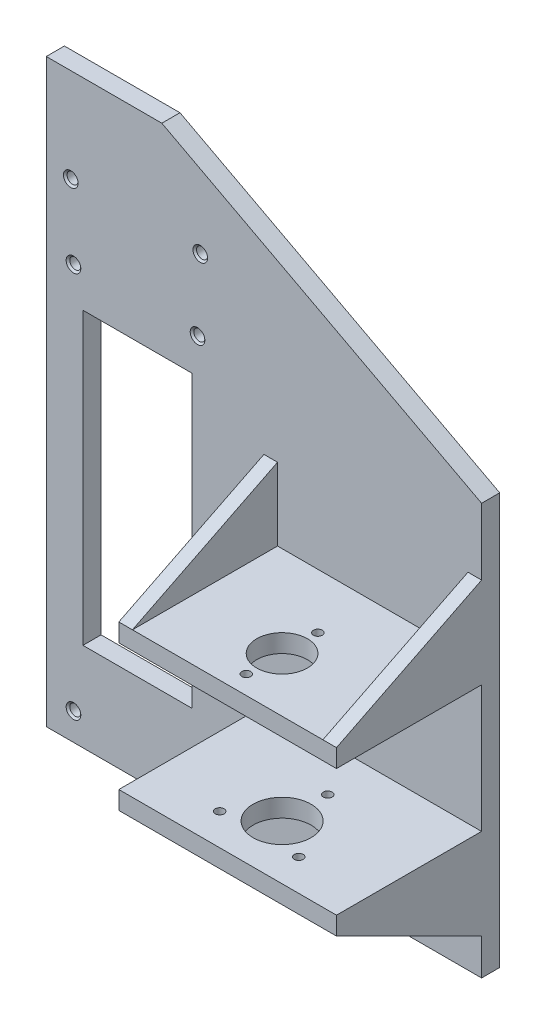
from build123d import *

# Parameters (mm, degrees)
SKETCH1_W                             = 152.4
SKETCH1_H                             = 203.2
BASE_DEPTH                            = 6.35
SKETCH2_W                             = 76.2
SKETCH2_H                             = 6.35
MOUNT_WALLS_DEPTH                     = 50.8
MOUNT_SUPPORT_DEPTH                   = 4.7625
F_24_0_152_DIAMETER_HOLE1_D           = 3.8608
F_24_0_152_DIAMETER_HOLE1_CSINK_D     = 5.1308
F_24_0_152_DIAMETER_HOLE1_CSINK_ANGLE = 90
SKETCH6_R                             = 8.89
SKETCH6_R_2                           = 1.55
CUT_EXTRUDE1_DEPTH                    = 149.785256326
SKETCH7_R                             = 10.16
SKETCH7_R_2                           = 1.55
CUT_EXTRUDE2_DEPTH                    = 6.35
CUT_EXTRUDE3_REACH                    = 138.783
SKETCH8_W                             = 38.1
SKETCH8_H                             = 101.6


with BuildPart() as part:
    # Sketch1 → base (new body)
    with BuildSketch(Plane.XY):
        Rectangle(SKETCH1_W, SKETCH1_H)
    extrude(amount=BASE_DEPTH)

    # Sketch2 → mount walls (add)
    with BuildSketch(Plane.XY.offset(6.35)):
        with Locations((38.1, -9.525)):
            Rectangle(SKETCH2_W, SKETCH2_H)
        with Locations((38.1, -60.325)):
            Rectangle(SKETCH2_W, SKETCH2_H)
    extrude(amount=MOUNT_WALLS_DEPTH)

    # Sketch3 → mount support (add)
    with BuildSketch(Plane(origin=(76.2, 0, 0), x_dir=(0, 0, -1), z_dir=(1, 0, 0))):
        Polygon((-6.35, -88.9), (-57.15, -63.5), (-6.35, -63.5), align=None)
        Polygon((-57.15, -6.35), (-6.35, 19.05), (-6.35, -6.35), align=None)
    mount_support = extrude(amount=-MOUNT_SUPPORT_DEPTH)

    # Mirror1: mount support across plane
    add(mount_support.mirror(Plane(origin=(38.1, 0, 0), x_dir=(0, 0, 1), z_dir=(1, 0, 0))))

    # #24 (0.152) Diameter Hole1 (through all)
    with Locations(Plane.XY.offset(6.35)):
        with Locations((-66.675, -92.075), (-66.675, 43.307), (-23.241, 43.307), (-23.241, -92.075), (-67.6275, 68.707), (-22.2885, 68.707)):
            CounterSinkHole(F_24_0_152_DIAMETER_HOLE1_D / 2, F_24_0_152_DIAMETER_HOLE1_CSINK_D / 2, counter_sink_angle=F_24_0_152_DIAMETER_HOLE1_CSINK_ANGLE)

    # Sketch6 → Cut-Extrude1 (cut, through all)
    with BuildSketch(Plane.XZ.offset(12.7)):
        with Locations((38.1, 38.1)):
            Circle(SKETCH6_R)
        with Locations((38.1, 50.62855)):
            Circle(SKETCH6_R_2)
        with Locations((38.1, 25.57145)):
            Circle(SKETCH6_R_2)
    extrude(amount=-CUT_EXTRUDE1_DEPTH, mode=Mode.SUBTRACT)

    # Sketch7 → Cut-Extrude2 (cut)
    with BuildSketch(Plane(origin=(0, -57.15, 0), x_dir=(1, 0, 0), z_dir=(0, 1, 0))):
        with Locations(Location((38.1, -38.1, 0), (0, 0, 180))):
            Circle(SKETCH7_R)
        with Locations(Location((24.2576, -46.091913366, 0), (0, 0, 180))):
            Circle(SKETCH7_R_2)
        with Locations(Location((38.1, -22.116173268, 0), (0, 0, 180))):
            Circle(SKETCH7_R_2)
        with Locations(Location((51.9424, -46.091913366, 0), (0, 0, 180))):
            Circle(SKETCH7_R_2)
    extrude(amount=-CUT_EXTRUDE2_DEPTH, mode=Mode.SUBTRACT)

    # Sketch8 → Cut-Extrude3 (cut, up to next)
    with BuildSketch(Plane.XY.offset(6.35), mode=Mode.PRIVATE) as cut_extrude3_sk1:
        Polygon((76.2, 42.338114892), (-35.744340046, 101.6), (76.2, 101.6), align=None)
    cut_extrude3_tool1 = extrude(cut_extrude3_sk1.sketch, amount=-CUT_EXTRUDE3_REACH, mode=Mode.PRIVATE) & part.part
    # Sketch8 → Cut-Extrude3 (cut, up to next)
    with BuildSketch(Plane.XY.offset(6.35), mode=Mode.PRIVATE) as cut_extrude3_sk2:
        with Locations((-44.31191896, -19.722477487)):
            Rectangle(SKETCH8_W, SKETCH8_H)
    cut_extrude3_tool2 = extrude(cut_extrude3_sk2.sketch, amount=-CUT_EXTRUDE3_REACH, mode=Mode.PRIVATE) & part.part
    add(cut_extrude3_tool1.solids().sort_by_distance((38.88522, 81.846038, 6.35))[0], mode=Mode.SUBTRACT)
    add(cut_extrude3_tool2.solids().sort_by_distance((-44.311919, -19.722477, 6.35))[0], mode=Mode.SUBTRACT)


solid = part.part
